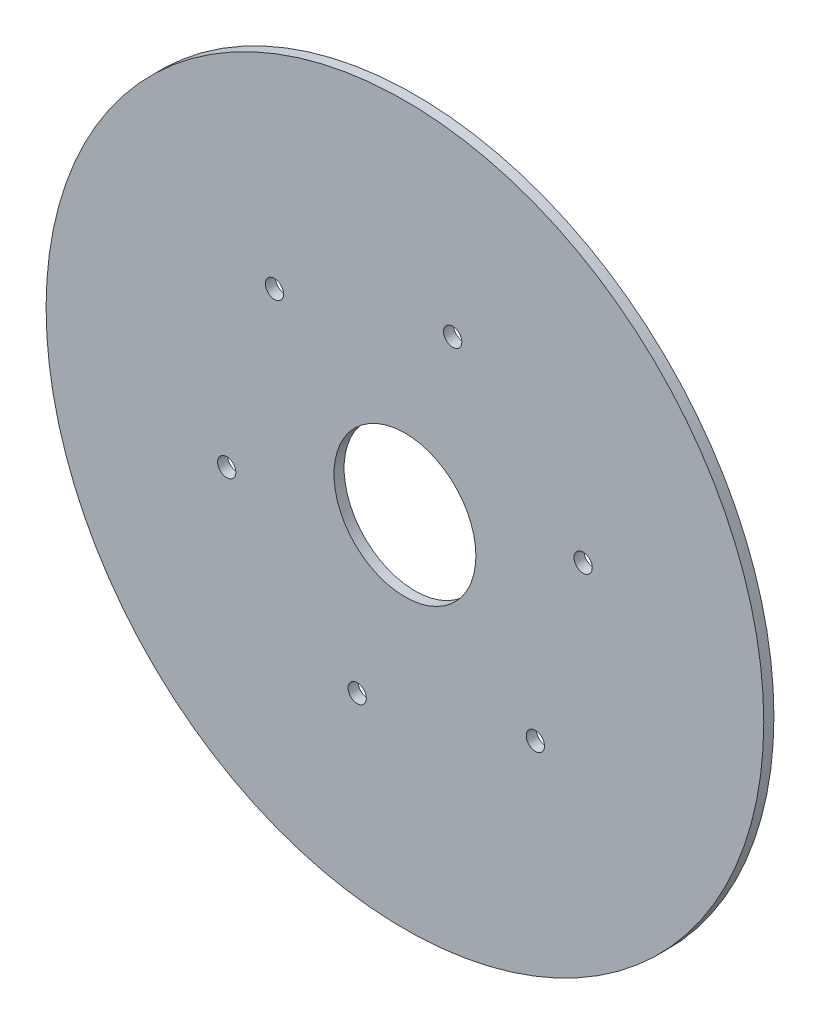
from build123d import *

# Parameters (mm, degrees)
FRONT_COVER_REFERENCE_START = 47.5
SKETCH_1_R                  = 88.5
SKETCH_1_R_2                = 17.5
FRONT_COVER_REFERENCE_DEPTH = 2.5
SKETCH_2_R                  = 2.25
THROUGH_HOLES_DEPTH         = 100


with BuildPart() as part:
    # Эскиз1 → Front_cover_reference (new body)
    with BuildSketch(Plane.XY.offset(FRONT_COVER_REFERENCE_START)):
        Circle(SKETCH_1_R)
        Circle(SKETCH_1_R_2, mode=Mode.SUBTRACT)
    extrude(amount=FRONT_COVER_REFERENCE_DEPTH)

    # Эскиз2 → Through_holes (cut, symmetric)
    with BuildSketch(Plane.XY):
        with Locations((43.949625096, 11.776266552)):
            Circle(SKETCH_2_R)
        with Locations((11.776266552, 43.949625096)):
            Circle(SKETCH_2_R)
        with Locations((-32.173358544, 32.173358544)):
            Circle(SKETCH_2_R)
        with Locations((-43.949625096, -11.776266552)):
            Circle(SKETCH_2_R)
        with Locations((-11.776266552, -43.949625096)):
            Circle(SKETCH_2_R)
        with Locations((32.173358544, -32.173358544)):
            Circle(SKETCH_2_R)
    extrude(amount=THROUGH_HOLES_DEPTH, both=True, mode=Mode.SUBTRACT)


solid = part.part
